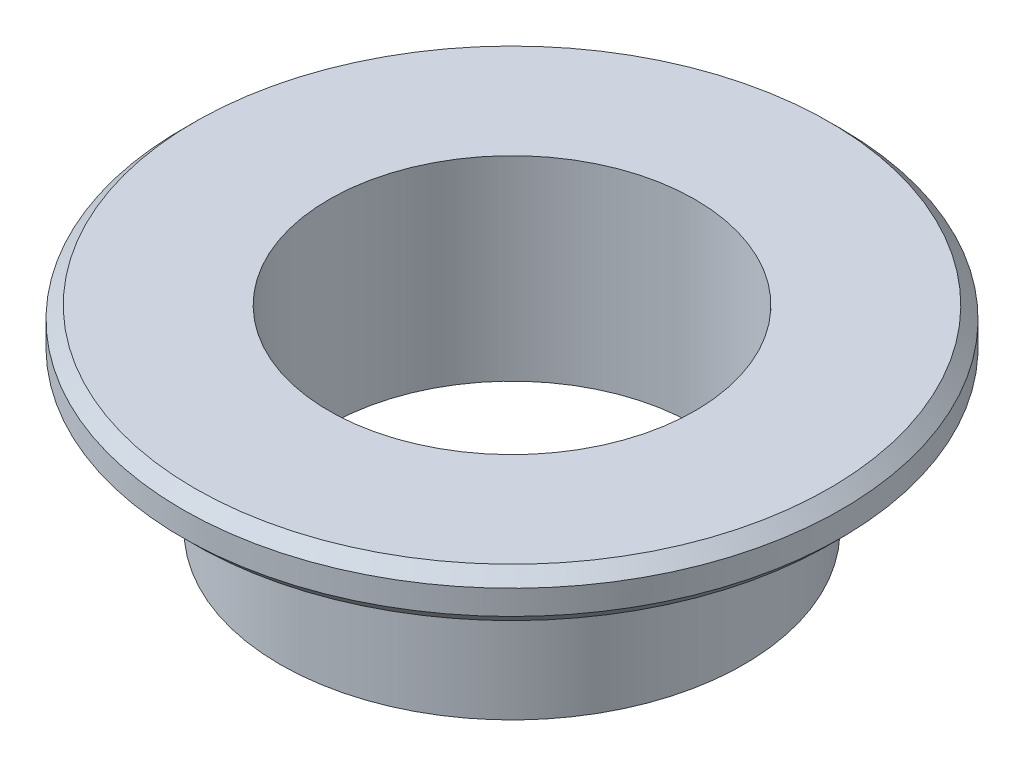
from build123d import *

# Parameters (mm, degrees)
CHAMFER1_SIZE = 0.5


with BuildPart() as part:
    # Sketch1 → Revolve1 (revolve)
    with BuildSketch(Plane.XY, mode=Mode.PRIVATE) as revolve1_sk:
        Polygon((7.5, 8), (7.5, 0), (9.5, 0), (9.5, 6), (13.5, 6), (13.5, 8), align=None)
    revolve(revolve1_sk.sketch.rotate(Axis((0, 0, 0), (0, 1, 0)), 90), axis=Axis((0, 0, 0), (0, 1, 0)))

    # Chamfer1
    chamfer1_edges = [part.edges().sort_by_distance(p)[0] for p in [
        (0, 8, 13.5),
        (0, 6, 13.5),
    ]]
    chamfer(chamfer1_edges, length=CHAMFER1_SIZE)


solid = part.part
